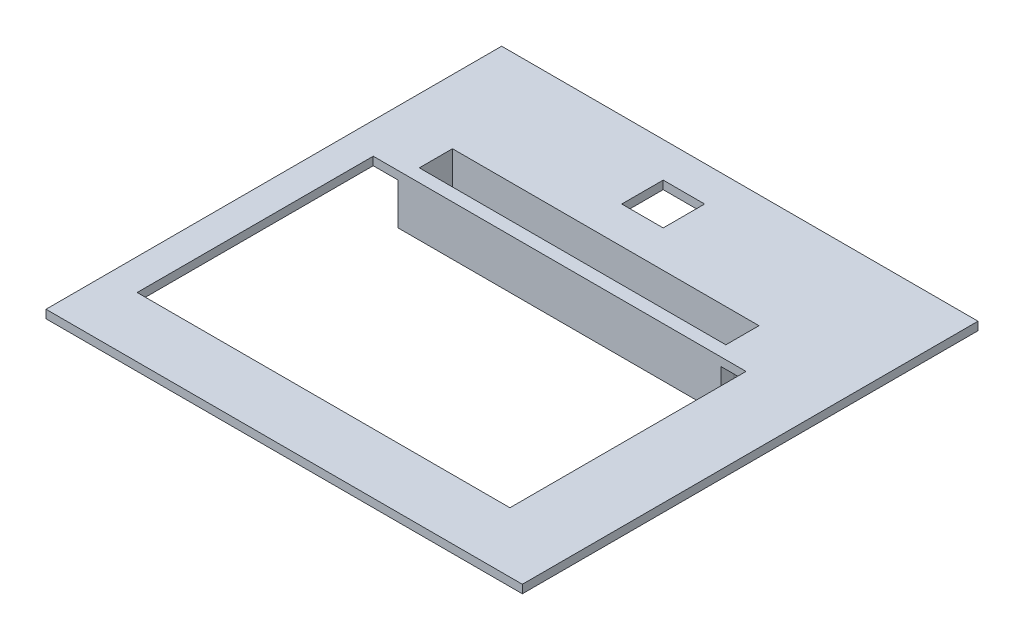
from build123d import *

# Parameters (mm, degrees)
SKETCH2_W               = 115
SKETCH2_H               = 110
BOSS_EXTRUDE1_DEPTH     = 2
CUT_EXTRUDE1_DEPTH      = 80.594283714
CUT_EXTRUDE1_DEPTH_BACK = 80.594283714
SKETCH3_W               = 90
SKETCH3_H               = 57
SKETCH4_W               = 10
SKETCH4_H               = 10
CUT_EXTRUDE2_DEPTH      = 2
SKETCH5_W               = 78
SKETCH5_H               = 8
CUT_EXTRUDE3_DEPTH      = 80.594283714
SKETCH6_W               = 78.002684591
SKETCH6_H               = 3.125
BOSS_EXTRUDE3_DEPTH     = 10
BOSS_EXTRUDE6_DEPTH     = 10
SKETCH10_W              = 2
SKETCH10_H              = 8
BOSS_EXTRUDE7_DEPTH     = 12
SKETCH11_W              = 2
SKETCH11_H              = 8
BOSS_EXTRUDE8_DEPTH     = 12
SKETCH12_W              = 15
SKETCH12_H              = 3
BOSS_EXTRUDE9_DEPTH     = 10
SKETCH13_W              = 15
SKETCH13_H              = 3
BOSS_EXTRUDE10_DEPTH    = 10
SKETCH14_W              = 74
SKETCH14_H              = 8
BOSS_EXTRUDE11_DEPTH    = 2
SKETCH17_R              = 2.375
CUT_EXTRUDE4_DEPTH      = 81.195074662
SKETCH18_W              = 10
SKETCH18_H              = 10
BOSS_EXTRUDE12_DEPTH    = 2
CUT_EXTRUDE5_DEPTH      = 81.468938107
CUT_EXTRUDE5_DEPTH_BACK = 81.468938107
SKETCH20_W              = 10
SKETCH20_H              = 10


with BuildPart() as part:
    # Sketch2 → Boss-Extrude1 (new body)
    with BuildSketch(Plane(origin=(0, 0, 0), x_dir=(1, 0, 0), z_dir=(0, 1, 0))):
        Rectangle(SKETCH2_W, SKETCH2_H)
    extrude(amount=BOSS_EXTRUDE1_DEPTH)

    # Sketch3 → Cut-Extrude1 (cut, two sides: drawn at the far end of the back side and taken through both)
    with BuildSketch(Plane(origin=(0, 2, 0), x_dir=(1, 0, 0), z_dir=(0, 1, 0)).offset(-CUT_EXTRUDE1_DEPTH_BACK)):
        with Locations((-5, -12)):
            Rectangle(SKETCH3_W, SKETCH3_H)
    extrude(amount=CUT_EXTRUDE1_DEPTH + CUT_EXTRUDE1_DEPTH_BACK, mode=Mode.SUBTRACT)

    # Sketch4 → Cut-Extrude2 (cut)
    with BuildSketch(Plane(origin=(0, 2, 0), x_dir=(1, 0, 0), z_dir=(0, 1, 0))):
        with Locations((-5, 35.75)):
            Rectangle(SKETCH4_W, SKETCH4_H)
    extrude(amount=-CUT_EXTRUDE2_DEPTH, mode=Mode.SUBTRACT)

    # Sketch5 → Cut-Extrude3 (cut, through all)
    with BuildSketch(Plane(origin=(0, 2, 0), x_dir=(1, 0, 0), z_dir=(0, 1, 0))):
        with Locations((-5, 23.625)):
            Rectangle(SKETCH5_W, SKETCH5_H)
    extrude(amount=-CUT_EXTRUDE3_DEPTH, mode=Mode.SUBTRACT)

    # Sketch6 → Boss-Extrude3 (add)
    with BuildSketch(Plane(origin=(0, 0, 0), x_dir=(-1, 0, 0), z_dir=(0, -1, 0))):
        with Locations((4.998657704, 18.0625)):
            Rectangle(SKETCH6_W, SKETCH6_H)
    extrude(amount=BOSS_EXTRUDE3_DEPTH)

    # Sketch8 → Boss-Extrude6 (add)
    with BuildSketch(Plane(origin=(0, 0, 0), x_dir=(-1, 0, 0), z_dir=(0, -1, 0))):
        Polygon((-34, 28.625), (-34, 27.625), (-32, 27.625), (42, 27.625), (44, 27.625), (44, 28.625), (29, 28.625), (-19, 28.625), align=None)
    extrude(amount=BOSS_EXTRUDE6_DEPTH)

    # Sketch10 → Boss-Extrude7 (add)
    with BuildSketch(Plane(origin=(0, 2, 0), x_dir=(1, 0, 0), z_dir=(0, 1, 0))):
        with Locations((33, 23.625)):
            Rectangle(SKETCH10_W, SKETCH10_H)
    extrude(amount=-BOSS_EXTRUDE7_DEPTH)

    # Sketch11 → Boss-Extrude8 (add)
    with BuildSketch(Plane(origin=(0, 2, 0), x_dir=(1, 0, 0), z_dir=(0, 1, 0))):
        with Locations((-43, 23.625)):
            Rectangle(SKETCH11_W, SKETCH11_H)
    extrude(amount=-BOSS_EXTRUDE8_DEPTH)

    # Sketch12 → Boss-Extrude9 (add)
    with BuildSketch(Plane(origin=(0, 0, 0), x_dir=(-1, 0, 0), z_dir=(0, -1, 0))):
        with Locations((-26.5, 30.125)):
            Rectangle(SKETCH12_W, SKETCH12_H)
    extrude(amount=BOSS_EXTRUDE9_DEPTH)

    # Sketch13 → Boss-Extrude10 (add)
    with BuildSketch(Plane(origin=(0, 0, 0), x_dir=(-1, 0, 0), z_dir=(0, -1, 0))):
        with Locations((36.5, 30.125)):
            Rectangle(SKETCH13_W, SKETCH13_H)
    extrude(amount=BOSS_EXTRUDE10_DEPTH)

    # Sketch14 → Boss-Extrude11 (add)
    with BuildSketch(Plane(origin=(0, -10, 0), x_dir=(-1, 0, 0), z_dir=(0, -1, 0))):
        with Locations((5, 23.625)):
            Rectangle(SKETCH14_W, SKETCH14_H)
    extrude(amount=-BOSS_EXTRUDE11_DEPTH)

    # Sketch17 → Cut-Extrude4 (cut, through all)
    with BuildSketch(Plane(origin=(0, -8, 0), x_dir=(1, 0, 0), z_dir=(0, 1, 0))):
        with Locations(Location((25, 23.625, 0), (0, 0, 270))):
            Circle(SKETCH17_R)
        with Locations(Location((-35, 23.625, 0), (0, 0, 270))):
            Circle(SKETCH17_R)
        with Locations(Location((-26.43, 23.625, 0), (0, 0, 270))):
            Circle(SKETCH17_R)
        with Locations(Location((-17.86, 23.625, 0), (0, 0, 270))):
            Circle(SKETCH17_R)
        with Locations(Location((-0.72, 23.625, 0), (0, 0, 270))):
            Circle(SKETCH17_R)
        with Locations(Location((7.85, 23.625, 0), (0, 0, 270))):
            Circle(SKETCH17_R)
        with Locations(Location((16.42, 23.625, 0), (0, 0, 270))):
            Circle(SKETCH17_R)
        with Locations(Location((-9.29, 23.625, 0), (0, 0, 270))):
            Circle(SKETCH17_R)
    extrude(amount=-CUT_EXTRUDE4_DEPTH, mode=Mode.SUBTRACT)

    # Sketch18 → Boss-Extrude12 (add)
    with BuildSketch(Plane(origin=(0, 2, 0), x_dir=(1, 0, 0), z_dir=(0, 1, 0))):
        with Locations((-5, 35.75)):
            Rectangle(SKETCH18_W, SKETCH18_H)
    extrude(amount=-BOSS_EXTRUDE12_DEPTH)

    # Sketch20 → Cut-Extrude5 (cut, two sides: drawn at the far end of the back side and taken through both)
    with BuildSketch(Plane(origin=(0, 2, 0), x_dir=(1, 0, 0), z_dir=(0, 1, 0)).offset(-CUT_EXTRUDE5_DEPTH_BACK)):
        with Locations((-5, 41.5)):
            Rectangle(SKETCH20_W, SKETCH20_H)
    extrude(amount=CUT_EXTRUDE5_DEPTH + CUT_EXTRUDE5_DEPTH_BACK, mode=Mode.SUBTRACT)


solid = part.part
